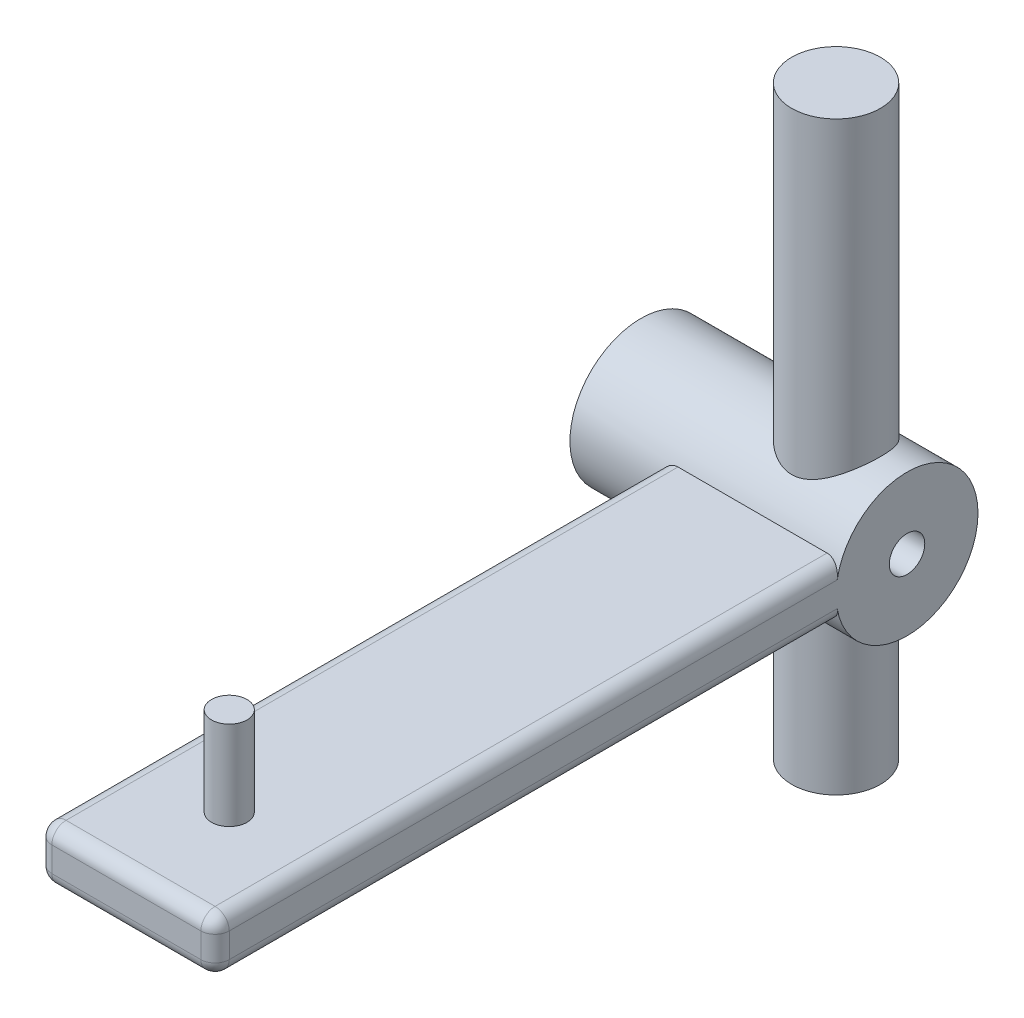
from build123d import *

# Parameters (mm, degrees)
SKETCH2_R                = 4
SKETCH2_R_2              = 1
BOSS_EXTRUDE1_DEPTH      = 15
SKETCH4_R                = 2.5
BOSS_EXTRUDE2_DEPTH      = 17
SKETCH6_R                = 2.5
BOSS_EXTRUDE3_DEPTH      = 16
SKETCH8_R                = 1
CUT_EXTRUDE1_DEPTH       = 27.115129868
SKETCH10_W               = 10
SKETCH10_H               = 3
BOSS_EXTRUDE4_DEPTH      = 35
FILLET1_R                = 0.8
BOSS_EXTRUDE5_REACH      = 45.486
BOSS_EXTRUDE5_END_RADIUS = 4
SKETCH12_R               = 1
BOSS_EXTRUDE6_DEPTH      = 5


with BuildPart() as part:
    # Sketch2 → Boss-Extrude1 (new body)
    with BuildSketch(Plane(origin=(0, 0, 0), x_dir=(0, 0, -1), z_dir=(1, 0, 0))):
        Circle(SKETCH2_R)
        Circle(SKETCH2_R_2, mode=Mode.SUBTRACT)
    extrude(amount=BOSS_EXTRUDE1_DEPTH)



with BuildPart() as body_2:
    # Sketch4 → Boss-Extrude2 (new body)
    with BuildSketch(Plane(origin=(15, 4, 0), x_dir=(1, 0, 0), z_dir=(0, 1, 0))):
        with Locations(Location((-4, 0, 0), (0, 0, 270))):
            Circle(SKETCH4_R)
    extrude(amount=BOSS_EXTRUDE2_DEPTH)


with BuildPart() as part_1:
    add(part.part)

    add(body_2.part)  # Boss-Extrude3 merges body 2
    # Sketch6 → Boss-Extrude3 (add)
    with BuildSketch(Plane.XZ.offset(-4)):
        with Locations(Location((11, 0, 0), (0, 0, 90))):
            Circle(SKETCH6_R)
    extrude(amount=BOSS_EXTRUDE3_DEPTH)

    # Sketch8 → Cut-Extrude1 (cut, through all)
    with BuildSketch(Plane(origin=(15, 0, 0), x_dir=(0, 0, -1), z_dir=(1, 0, 0))):
        Circle(SKETCH8_R)
    extrude(amount=-CUT_EXTRUDE1_DEPTH, mode=Mode.SUBTRACT)



with BuildPart() as body_2_2:
    # Sketch10 → Boss-Extrude4 (new body)
    with BuildSketch(Plane(origin=(15, 0, 4), x_dir=(1, 0, 0), z_dir=(0, 0, 1))):
        with Locations((-5, 0)):
            Rectangle(SKETCH10_W, SKETCH10_H)
    extrude(amount=BOSS_EXTRUDE4_DEPTH)

    # Fillet1
    fillet1_edges = [body_2_2.edges().sort_by_distance(p)[0] for p in [
        (10, -1.5, 39),
        (15, 0, 39),
        (10, 1.5, 39),
        (15, 1.5, 21.5),
        (15, -1.5, 21.5),
        (5, -1.5, 21.5),
        (5, 1.5, 21.5),
        (5, 0, 39),
    ]]
    fillet(fillet1_edges, radius=FILLET1_R)


with BuildPart() as part_2:
    add(part_1.part)

    add(body_2_2.part)  # Boss-Extrude5 merges body 2 2
    # Boss-Extrude5: up to this cylinder (the profile starts outside it)
    boss_extrude5_end = Plane(origin=(10, 0, 0), z_dir=(-1, 0, 0)) * Cylinder(BOSS_EXTRUDE5_END_RADIUS, 99.972, mode=Mode.PRIVATE)
    # Sketch11 → Boss-Extrude5 (add, up to the surface)
    with BuildSketch(Plane(origin=(15, 0, 4), x_dir=(1, 0, 0), z_dir=(0, 0, 1)), mode=Mode.PRIVATE) as boss_extrude5_sk1:
        with BuildLine():
            Line((-9.2, -1.5), (-0.8, -1.5))
            ThreePointArc((-0.8, -1.5), (-0.234314575, -1.265685425), (0, -0.7))
            Line((0, -0.7), (0, 0.7))
            ThreePointArc((0, 0.7), (-0.234314575, 1.265685425), (-0.8, 1.5))
            Line((-0.8, 1.5), (-9.2, 1.5))
            ThreePointArc((-9.2, 1.5), (-9.765685425, 1.265685425), (-10, 0.7))
            Line((-10, 0.7), (-10, -0.7))
            ThreePointArc((-10, -0.7), (-9.765685425, -1.265685425), (-9.2, -1.5))
        make_face()
    boss_extrude5_tool1 = extrude(boss_extrude5_sk1.sketch, amount=-BOSS_EXTRUDE5_REACH, mode=Mode.PRIVATE) - boss_extrude5_end
    add(boss_extrude5_tool1.solids().sort_by_distance((10, 0, 4))[0])
    add(boss_extrude5_tool1.solids().sort_by_distance((10, 0, 4))[1])

    # Sketch12 → Boss-Extrude6 (add)
    with BuildSketch(Plane(origin=(0, 1.5, 0), x_dir=(1, 0, 0), z_dir=(0, 1, 0))):
        with Locations((10, -33.2)):
            Circle(SKETCH12_R)
    extrude(amount=BOSS_EXTRUDE6_DEPTH)


solid = part_2.part
